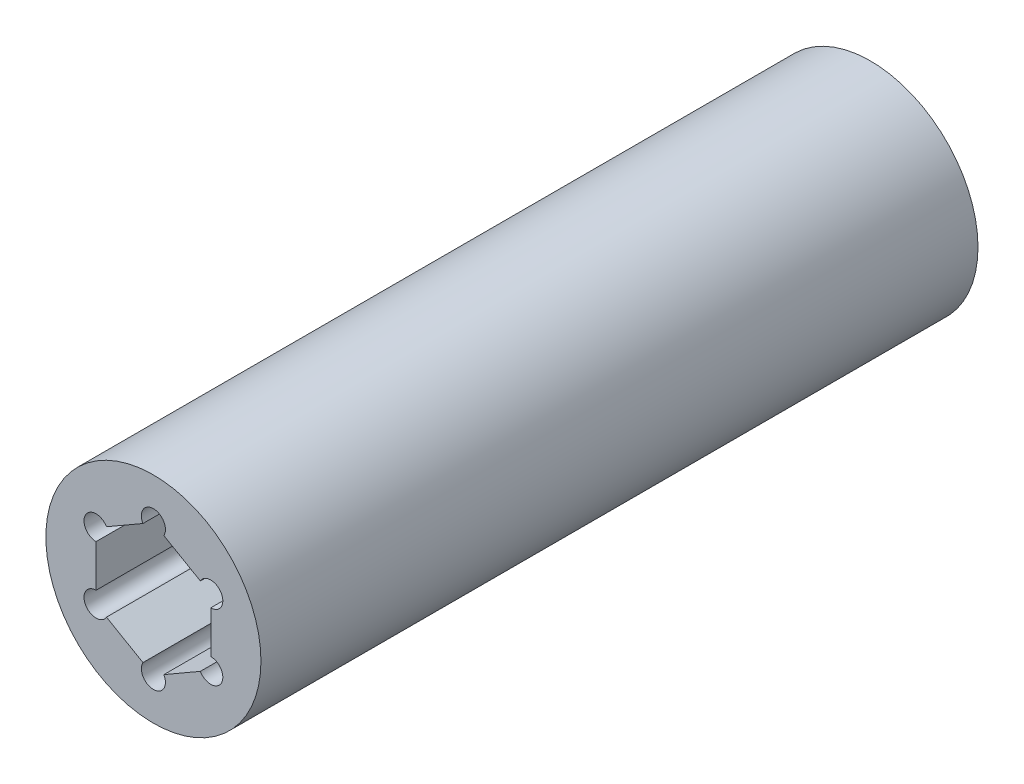
from build123d import *

# Parameters (mm, degrees)
SKETCH1_R           = 3
BOSS_EXTRUDE1_DEPTH = 20


with BuildPart() as part:
    # Sketch1 → Boss-Extrude1 (new body)
    with BuildSketch(Plane.XY):
        Circle(SKETCH1_R)
        with BuildLine():
            Line((-1.309090909, 1.091716873), (-0.290909091, 1.679564419))
            ThreePointArc((-0.290909091, 1.679564419), (-0.086940652, 2.171987791), (0.335912884, 1.847520861))
            ThreePointArc((0.335912884, 1.847520861), (0.32446693, 1.76058021), (0.290909091, 1.679564419))
            Line((0.290909091, 1.679564419), (1.309090909, 1.091716873))
            ThreePointArc((1.309090909, 1.091716873), (1.686940652, 1.248227361), (1.935912884, 0.923760431))
            ThreePointArc((1.935912884, 0.923760431), (1.837526278, 0.686234153), (1.6, 0.587847547))
            Line((1.6, 0.587847547), (1.6, -0.587847547))
            ThreePointArc((1.6, -0.587847547), (1.837526278, -0.686234153), (1.935912884, -0.923760431))
            ThreePointArc((1.935912884, -0.923760431), (1.686940652, -1.248227361), (1.309090909, -1.091716873))
            Line((1.309090909, -1.091716873), (0.290909091, -1.679564419))
            ThreePointArc((0.290909091, -1.679564419), (0.32446693, -1.76058021), (0.335912884, -1.847520861))
            ThreePointArc((0.335912884, -1.847520861), (-0.086940652, -2.171987791), (-0.290909091, -1.679564419))
            Line((-0.290909091, -1.679564419), (-1.309090909, -1.091716873))
            ThreePointArc((-1.309090909, -1.091716873), (-1.890909091, -1.091716873), (-1.6, -0.587847547))
            Line((-1.6, -0.587847547), (-1.6, 0.587847547))
            ThreePointArc((-1.6, 0.587847547), (-1.890909091, 1.091716873), (-1.309090909, 1.091716873))
        make_face(mode=Mode.SUBTRACT)
    extrude(amount=BOSS_EXTRUDE1_DEPTH)


solid = part.part
